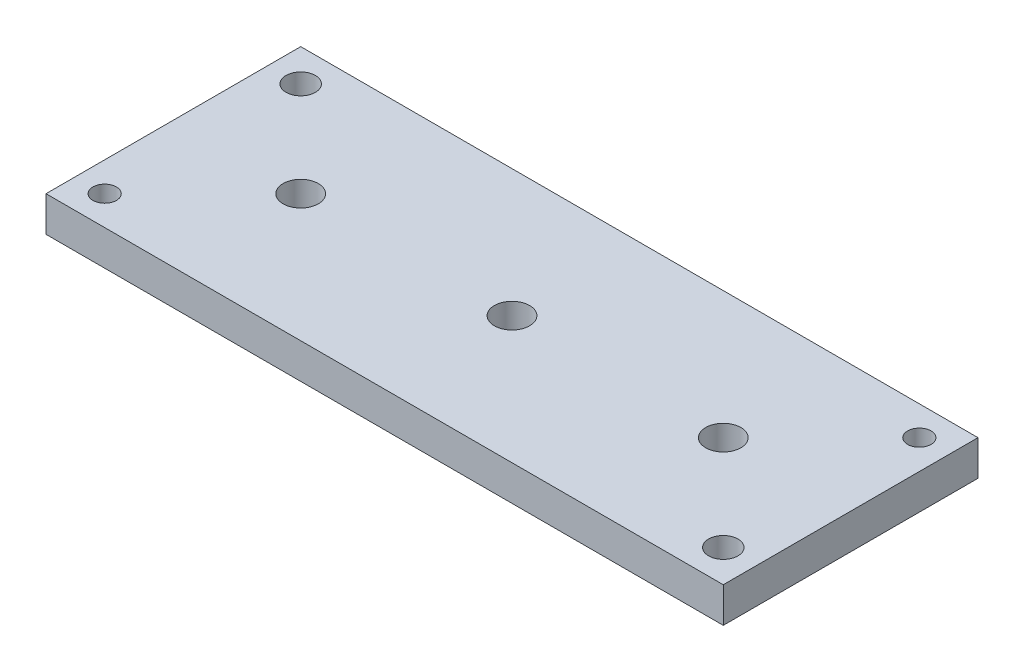
from build123d import *

# Parameters (mm, degrees)
SKETCH1_W           = 57.7
SKETCH1_H           = 21.7
BOSS_EXTRUDE1_DEPTH = 2
SKETCH2_W           = 57.7
SKETCH2_H           = 21.7
SKETCH2_W_2         = 54.7
SKETCH2_H_2         = 18.7
BOSS_EXTRUDE2_DEPTH = 75
FILLET1_R           = 8
SKETCH3_W           = 38.583587397
SKETCH3_H           = 2.5
CUT_EXTRUDE1_DEPTH  = 75
SKETCH4_W           = 17.089400488
SKETCH4_H           = 2.5
CUT_EXTRUDE2_DEPTH  = 75
SKETCH5_R           = 1
CUT_EXTRUDE3_DEPTH  = 8
BOSS_EXTRUDE3_START = 3
SKETCH6_W           = 57.7
SKETCH6_H           = 21.7
SKETCH6_R           = 1
SKETCH6_R_2         = 1.25
BOSS_EXTRUDE3_DEPTH = 3
CUT_EXTRUDE4_DEPTH  = 3
CUT_EXTRUDE5_START  = -3
SKETCH8_R           = 1.5
CUT_EXTRUDE5_DEPTH  = 3
SKETCH9_W           = 91.990762183
SKETCH9_H           = 98.377858587
CUT_EXTRUDE7_DEPTH  = 69


with BuildPart() as part:
    # Sketch1 → Boss-Extrude1 (new body)
    with BuildSketch(Plane(origin=(0, 0, 0), x_dir=(1, 0, 0), z_dir=(0, 1, 0))):
        with Locations((28.85, 10.85)):
            Rectangle(SKETCH1_W, SKETCH1_H)
    extrude(amount=BOSS_EXTRUDE1_DEPTH)

    # Sketch2 → Boss-Extrude2 (add)
    with BuildSketch(Plane(origin=(0, 2, 0), x_dir=(1, 0, 0), z_dir=(0, 1, 0))):
        with Locations((28.85, 10.85)):
            Rectangle(SKETCH2_W, SKETCH2_H)
        with Locations((28.85, 10.85)):
            Rectangle(SKETCH2_W_2, SKETCH2_H_2, mode=Mode.SUBTRACT)
    extrude(amount=BOSS_EXTRUDE2_DEPTH)

    # Fillet1
    fillet1_edges = [part.edges().sort_by_distance(p)[0] for p in [
        (1.5, 39.5, -20.2),
        (1.5, 39.5, -1.5),
        (56.2, 39.5, -1.5),
        (56.2, 39.5, -20.2),
    ]]
    fillet(fillet1_edges, radius=FILLET1_R)

    # Sketch3 → Cut-Extrude1 (cut)
    with BuildSketch(Plane(origin=(0, 77, 0), x_dir=(1, 0, 0), z_dir=(0, 1, 0))):
        with Locations((20.791793699, 18.95)):
            Rectangle(SKETCH3_W, SKETCH3_H)
    extrude(amount=-CUT_EXTRUDE1_DEPTH, mode=Mode.SUBTRACT)

    # Sketch4 → Cut-Extrude2 (cut)
    with BuildSketch(Plane(origin=(0, 77, 0), x_dir=(1, 0, 0), z_dir=(0, 1, 0))):
        with Locations((47.655299756, 2.75)):
            Rectangle(SKETCH4_W, SKETCH4_H)
    extrude(amount=-CUT_EXTRUDE2_DEPTH, mode=Mode.SUBTRACT)

    # Sketch5 → Cut-Extrude3 (cut)
    with BuildSketch(Plane(origin=(0, 77, 0), x_dir=(1, 0, 0), z_dir=(0, 1, 0))):
        with Locations(Location((55.2, 19.2, 0), (0, 0, 270))):
            Circle(SKETCH5_R)
        with Locations(Location((2.5, 2.5, 0), (0, 0, 270))):
            Circle(SKETCH5_R)
    extrude(amount=-CUT_EXTRUDE3_DEPTH, mode=Mode.SUBTRACT)

    # Sketch6 → Boss-Extrude3 (add)
    with BuildSketch(Plane(origin=(0, 77, 0), x_dir=(1, 0, 0), z_dir=(0, 1, 0)).offset(BOSS_EXTRUDE3_START)):
        with Locations((28.85, 10.85)):
            Rectangle(SKETCH6_W, SKETCH6_H)
        with Locations(Location((2.5, 2.5, 0), (0, 0, 270))):
            Circle(SKETCH6_R, mode=Mode.SUBTRACT)
        with Locations(Location((55.2, 19.2, 0), (0, 0, 270))):
            Circle(SKETCH6_R, mode=Mode.SUBTRACT)
        with Locations(Location((2.75, 18.95, 0), (0, 0, 270))):
            Circle(SKETCH6_R_2, mode=Mode.SUBTRACT)
        with Locations(Location((54.95, 2.75, 0), (0, 0, 270))):
            Circle(SKETCH6_R_2, mode=Mode.SUBTRACT)
    extrude(amount=-BOSS_EXTRUDE3_DEPTH)

    # Sketch7 → Cut-Extrude4 (cut)
    with BuildSketch(Plane(origin=(0, 80, 0), x_dir=(1, 0, 0), z_dir=(0, 1, 0))):
        with BuildLine():
            ThreePointArc((9.35, 10.85), (10.85, 9.35), (12.35, 10.85))
            Line((12.35, 10.85), (10.85, 10.85))
            Line((10.85, 10.85), (9.35, 10.85))
        make_face()
        with BuildLine():
            Line((10.85, 10.85), (12.35, 10.85))
            ThreePointArc((12.35, 10.85), (10.85, 12.35), (9.35, 10.85))
            Line((9.35, 10.85), (10.85, 10.85))
        make_face()
        with BuildLine():
            ThreePointArc((27.35, 10.85), (28.85, 9.35), (30.35, 10.85))
            Line((30.35, 10.85), (28.85, 10.85))
            Line((28.85, 10.85), (27.35, 10.85))
        make_face()
        with BuildLine():
            Line((28.85, 10.85), (30.35, 10.85))
            ThreePointArc((30.35, 10.85), (28.85, 12.35), (27.35, 10.85))
            Line((27.35, 10.85), (28.85, 10.85))
        make_face()
        with BuildLine():
            ThreePointArc((45.35, 10.85), (46.85, 9.35), (48.35, 10.85))
            Line((48.35, 10.85), (46.85, 10.85))
            Line((46.85, 10.85), (45.35, 10.85))
        make_face()
        with BuildLine():
            Line((46.85, 10.85), (48.35, 10.85))
            ThreePointArc((48.35, 10.85), (46.85, 12.35), (45.35, 10.85))
            Line((45.35, 10.85), (46.85, 10.85))
        make_face()
    extrude(amount=-CUT_EXTRUDE4_DEPTH, mode=Mode.SUBTRACT)

    # Sketch8 → Cut-Extrude5 (cut)
    with BuildSketch(Plane.XZ.offset(CUT_EXTRUDE5_START)):
        with Locations(Location((10.85, -10.85, 0), (0, 0, 90))):
            Circle(SKETCH8_R)
        with Locations(Location((28.85, -10.85, 0), (0, 0, 90))):
            Circle(SKETCH8_R)
        with Locations(Location((46.85, -10.85, 0), (0, 0, 90))):
            Circle(SKETCH8_R)
    extrude(amount=CUT_EXTRUDE5_DEPTH, mode=Mode.SUBTRACT)

    # Sketch9 → Cut-Extrude7 (cut)
    with BuildSketch(Plane(origin=(0, 0, -21.7), x_dir=(-1, 0, 0), z_dir=(0, 0, -1))):
        with Locations((-24.534497704, 27.811070706)):
            Rectangle(SKETCH9_W, SKETCH9_H)
    extrude(amount=-CUT_EXTRUDE7_DEPTH, mode=Mode.SUBTRACT)


solid = part.part
